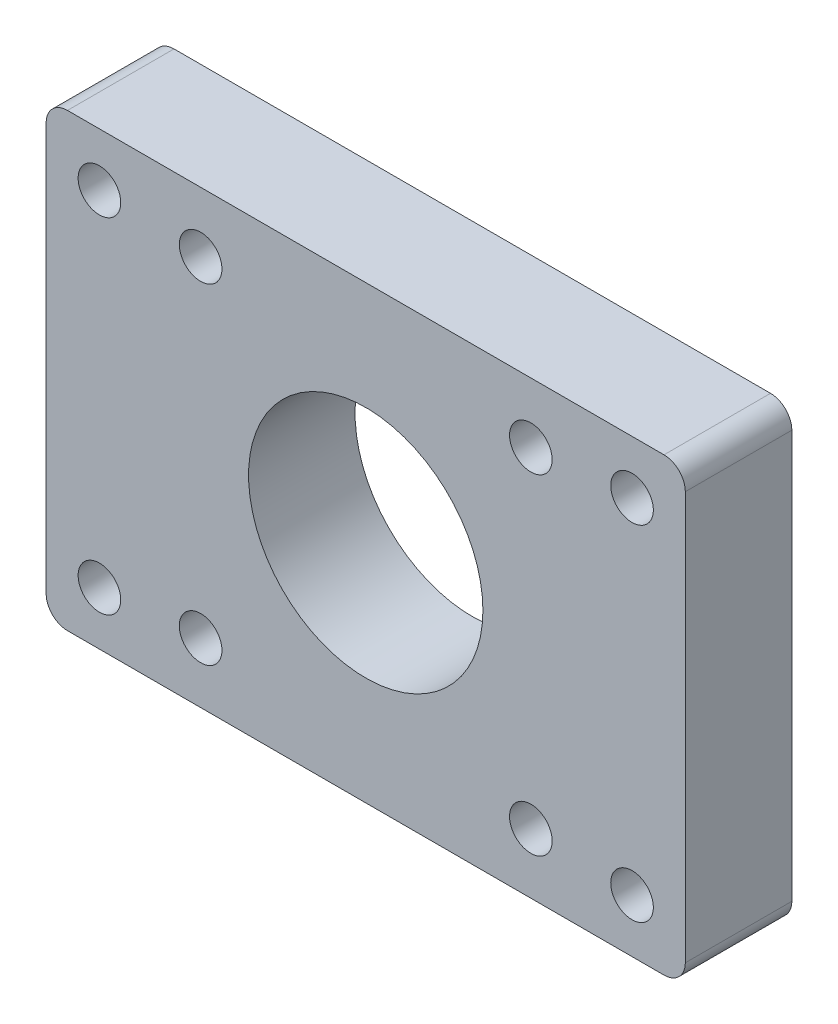
from build123d import *

# Parameters (mm, degrees)
ESQUISSE1_W             = 60
ESQUISSE1_H             = 42.3
ESQUISSE1_R             = 2
BOSS_EXTRU_1_DEPTH      = 10
ESQUISSE2_R             = 11
ENL_V_MAT_EXTRU_1_DEPTH = 10
CONG_1_R                = 2


with BuildPart() as part:
    # Esquisse1 → Boss.-Extru.1 (new body)
    with BuildSketch(Plane.XY):
        Rectangle(ESQUISSE1_W, ESQUISSE1_H)
        with Locations((15.5, 15.5)):
            Circle(ESQUISSE1_R, mode=Mode.SUBTRACT)
        with Locations(Location((-15.5, 15.5, 0), (0, 0, 180))):
            Circle(ESQUISSE1_R, mode=Mode.SUBTRACT)
        with Locations(Location((15.5, -15.5, 0), (0, 0, 180))):
            Circle(ESQUISSE1_R, mode=Mode.SUBTRACT)
        with Locations((-15.5, -15.5)):
            Circle(ESQUISSE1_R, mode=Mode.SUBTRACT)
        with Locations((25, 16.15)):
            Circle(ESQUISSE1_R, mode=Mode.SUBTRACT)
        with Locations(Location((-25, 16.15, 0), (0, 0, 180))):
            Circle(ESQUISSE1_R, mode=Mode.SUBTRACT)
        with Locations((-25, -16.15)):
            Circle(ESQUISSE1_R, mode=Mode.SUBTRACT)
        with Locations(Location((25, -16.15, 0), (0, 0, 180))):
            Circle(ESQUISSE1_R, mode=Mode.SUBTRACT)
    extrude(amount=BOSS_EXTRU_1_DEPTH)

    # Esquisse2 → Enlèv. mat.-Extru.1 (cut)
    with BuildSketch(Plane.XY.offset(10)):
        Circle(ESQUISSE2_R)
    extrude(amount=-ENL_V_MAT_EXTRU_1_DEPTH, mode=Mode.SUBTRACT)

    # Congé1
    cong_1_edges = [part.edges().sort_by_distance(p)[0] for p in [
        (30, -21.15, 5),
        (-30, -21.15, 5),
        (-30, 21.15, 5),
        (30, 21.15, 5),
    ]]
    fillet(cong_1_edges, radius=CONG_1_R)


solid = part.part
